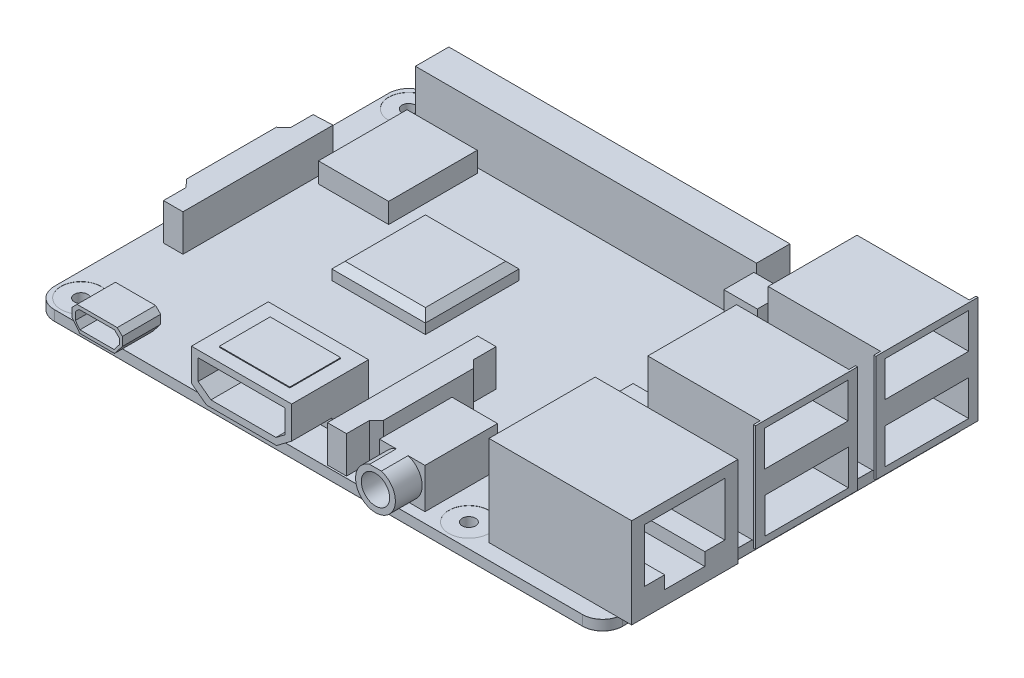
from build123d import *

# Parameters (mm, degrees)
SKETCH1_R             = 1
BOSS_EXTRUDE1_DEPTH   = 1.4732
SKETCH2_R             = 3
BOSS_EXTRUDE2_DEPTH   = 0.0254
BOSS_EXTRUDE3_START   = -1.4732
SKETCH2_2_R           = 3
BOSS_EXTRUDE3_DEPTH   = 0.0254
SKETCH3_W             = 51
SKETCH3_H             = 5
BOSS_EXTRUDE4_DEPTH   = 8.5
SKETCH3_W_2           = 5
SKETCH3_H_2           = 4.5
BOSS_EXTRUDE4_2_DEPTH = 8.5
BOSS_EXTRUDE5_DEPTH   = 16
BOSS_EXTRUDE5_2_DEPTH = 16
SKETCH5_W             = 21.336
SKETCH5_H             = 15.875
BOSS_EXTRUDE6_DEPTH   = 13.5
SKETCH6_W             = 14.986
SKETCH6_H             = 11.4935
BOSS_EXTRUDE7_DEPTH   = 6.5
BOSS_EXTRUDE8_DEPTH   = 5.5
BOSS_EXTRUDE8_2_DEPTH = 5.5
SKETCH8_W             = 6.8072
SKETCH8_H             = 14.8463
BOSS_EXTRUDE9_DEPTH   = 6
SKETCH9_OUTSIDE_W     = 110.289
SKETCH9_OUTSIDE_H     = 40.784
SKETCH9_OUTSIDE_R     = 2.97735223
CUT_EXTRUDE1_DEPTH    = 4
SKETCH10_R            = 2.119738605
CUT_EXTRUDE2_DEPTH    = 12
CUT_EXTRUDE3_DEPTH    = 6
SKETCH12_W            = 10.548519486
SKETCH12_H            = 7.613183642
BOSS_EXTRUDE10_DEPTH  = 0.127
SKETCH13_W            = 10.5
SKETCH13_H            = 13.25
BOSS_EXTRUDE11_DEPTH  = 3
SKETCH14_W            = 14
SKETCH14_H            = 14
BOSS_EXTRUDE12_DEPTH  = 2.5
CHAMFER1_SIZE         = 1
SKETCH15_W            = 7.5311
SKETCH15_H            = 5.7277
BOSS_EXTRUDE13_DEPTH  = 3.556
SKETCH16_OUTSIDE_W    = 110.289
SKETCH16_OUTSIDE_H    = 40.784
CUT_EXTRUDE4_DEPTH    = 106.594447386
SKETCH20_W            = 9
SKETCH20_H            = 9
BOSS_EXTRUDE15_DEPTH  = 1
SKETCH23_W            = 12.5
SKETCH23_H            = 5.3
CUT_EXTRUDE6_DEPTH    = 13
SKETCH26_W            = 12.5
SKETCH26_H            = 5.3
CUT_EXTRUDE7_DEPTH    = 13
SKETCH27_W            = 12
SKETCH27_H            = 8
SKETCH27_W_2          = 6
SKETCH27_H_2          = 1.922043348
CUT_EXTRUDE8_DEPTH    = 13
CUT_EXTRUDE9_DEPTH    = 10
CUT_EXTRUDE10_DEPTH   = 4


with BuildPart() as part:
    # Sketch1 → Boss-Extrude1 (new body)
    with BuildSketch(Plane(origin=(0, 0, 0), x_dir=(1, 0, 0), z_dir=(0, 1, 0))):
        with BuildLine():
            Line((3, 0), (82, 0))
            ThreePointArc((82, 0), (84.121320344, 0.878679656), (85, 3))
            Line((85, 3), (85, 53))
            ThreePointArc((85, 53), (84.121320344, 55.121320344), (82, 56))
            Line((82, 56), (3, 56))
            ThreePointArc((3, 56), (0.878679656, 55.121320344), (0, 53))
            Line((0, 53), (0, 3))
            ThreePointArc((0, 3), (0.878679656, 0.878679656), (3, 0))
        make_face()
        with Locations(Location((3.5, 52.5, 0), (0, 0, 270))):
            Circle(SKETCH1_R, mode=Mode.SUBTRACT)
        with Locations(Location((3.5, 3.5, 0), (0, 0, 270))):
            Circle(SKETCH1_R, mode=Mode.SUBTRACT)
        with Locations(Location((61.5, 3.5, 0), (0, 0, 90))):
            Circle(SKETCH1_R, mode=Mode.SUBTRACT)
        with Locations(Location((61.5, 52.5, 0), (0, 0, 90))):
            Circle(SKETCH1_R, mode=Mode.SUBTRACT)
    extrude(amount=BOSS_EXTRUDE1_DEPTH)


with BuildPart() as body_2:
    # Sketch2 → Boss-Extrude2 (new body)
    with BuildSketch(Plane(origin=(0, 1.4732, 0), x_dir=(1, 0, 0), z_dir=(0, 1, 0))):
        with BuildLine():
            Line((3, 56), (82, 56))
            ThreePointArc((82, 56), (84.121320344, 55.121320344), (85, 53))
            Line((85, 53), (85, 3))
            ThreePointArc((85, 3), (84.121320344, 0.878679656), (82, 0))
            Line((82, 0), (3, 0))
            ThreePointArc((3, 0), (0.878679656, 0.878679656), (0, 3))
            Line((0, 3), (0, 53))
            ThreePointArc((0, 53), (0.878679656, 55.121320344), (3, 56))
        make_face()
        with Locations(Location((3.5, 52.5, 0), (0, 0, 270))):
            Circle(SKETCH2_R, mode=Mode.SUBTRACT)
        with Locations(Location((3.5, 3.5, 0), (0, 0, 270))):
            Circle(SKETCH2_R, mode=Mode.SUBTRACT)
        with Locations(Location((61.5, 52.5, 0), (0, 0, 90))):
            Circle(SKETCH2_R, mode=Mode.SUBTRACT)
        with Locations(Location((61.5, 3.5, 0), (0, 0, 90))):
            Circle(SKETCH2_R, mode=Mode.SUBTRACT)
    extrude(amount=BOSS_EXTRUDE2_DEPTH)


with BuildPart() as body_3:
    # Sketch2<2> → Boss-Extrude3 (new body)
    with BuildSketch(Plane(origin=(0, 1.4732, 0), x_dir=(1, 0, 0), z_dir=(0, 1, 0)).offset(BOSS_EXTRUDE3_START)):
        with BuildLine():
            Line((3, 56), (82, 56))
            ThreePointArc((82, 56), (84.121320344, 55.121320344), (85, 53))
            Line((85, 53), (85, 3))
            ThreePointArc((85, 3), (84.121320344, 0.878679656), (82, 0))
            Line((82, 0), (3, 0))
            ThreePointArc((3, 0), (0.878679656, 0.878679656), (0, 3))
            Line((0, 3), (0, 53))
            ThreePointArc((0, 53), (0.878679656, 55.121320344), (3, 56))
        make_face()
        with Locations(Location((3.5, 52.5, 0), (0, 0, 90))):
            Circle(SKETCH2_2_R, mode=Mode.SUBTRACT)
        with Locations(Location((3.5, 3.5, 0), (0, 0, 90))):
            Circle(SKETCH2_2_R, mode=Mode.SUBTRACT)
        with Locations(Location((61.5, 52.5, 0), (0, 0, 90))):
            Circle(SKETCH2_2_R, mode=Mode.SUBTRACT)
        with Locations(Location((61.5, 3.5, 0), (0, 0, 90))):
            Circle(SKETCH2_2_R, mode=Mode.SUBTRACT)
    extrude(amount=-BOSS_EXTRUDE3_DEPTH)


with BuildPart() as body_4:
    # Sketch3 → Boss-Extrude4 (new body)
    with BuildSketch(Plane(origin=(0, 1.4986, 0), x_dir=(1, 0, 0), z_dir=(0, 1, 0))):
        with Locations((32.5, 52.5)):
            Rectangle(SKETCH3_W, SKETCH3_H)
    extrude(amount=BOSS_EXTRUDE4_DEPTH)


with BuildPart() as body_5:
    # Sketch3 → Boss-Extrude4 2 (new body)
    with BuildSketch(Plane(origin=(0, 1.4986, 0), x_dir=(1, 0, 0), z_dir=(0, 1, 0))):
        with Locations((61.5, 46.377)):
            Rectangle(SKETCH3_W_2, SKETCH3_H_2)
    extrude(amount=BOSS_EXTRUDE4_2_DEPTH)


with BuildPart() as body_6:
    # Sketch4 → Boss-Extrude5 (new body)
    with BuildSketch(Plane(origin=(0, 1.4986, 0), x_dir=(1, 0, 0), z_dir=(0, 1, 0))):
        Polygon((86.1842, 40.3579), (86.1842, 39.3579), (86.4842, 39.3579), (86.4842, 54.6421), (86.1842, 54.6421), (86.1842, 53.6421), (69.39, 53.6421), (69.39, 40.3579), align=None)
    extrude(amount=BOSS_EXTRUDE5_DEPTH)

    # Sketch23 → Cut-Extrude6 (cut)
    with BuildSketch(Plane(origin=(86.4842, 0, 0), x_dir=(0, 0, -1), z_dir=(1, 0, 0))):
        with Locations((47, 13.8486)):
            Rectangle(SKETCH23_W, SKETCH23_H)
        with Locations((47, 5.1486)):
            Rectangle(SKETCH23_W, SKETCH23_H)
    extrude(amount=-CUT_EXTRUDE6_DEPTH, mode=Mode.SUBTRACT)


with BuildPart() as body_7:
    # Sketch4 → Boss-Extrude5 2 (new body)
    with BuildSketch(Plane(origin=(0, 1.4986, 0), x_dir=(1, 0, 0), z_dir=(0, 1, 0))):
        Polygon((86.1842, 21.3579), (86.1842, 22.3579), (69.39, 22.3579), (69.39, 35.6421), (86.1842, 35.6421), (86.1842, 36.6421), (86.4842, 36.6421), (86.4842, 21.3579), align=None)
    extrude(amount=BOSS_EXTRUDE5_2_DEPTH)

    # Sketch26 → Cut-Extrude7 (cut)
    with BuildSketch(Plane(origin=(86.4842, 0, 0), x_dir=(0, 0, -1), z_dir=(1, 0, 0))):
        with Locations((28.968026832, 13.8486)):
            Rectangle(SKETCH26_W, SKETCH26_H)
        with Locations((29.031973168, 5.1486)):
            Rectangle(SKETCH26_W, SKETCH26_H)
    extrude(amount=-CUT_EXTRUDE7_DEPTH, mode=Mode.SUBTRACT)


with BuildPart() as body_8:
    # Sketch5 → Boss-Extrude6 (new body)
    with BuildSketch(Plane(origin=(0, 1.4986, 0), x_dir=(1, 0, 0), z_dir=(0, 1, 0))):
        with Locations((76.360727816, 10.25)):
            Rectangle(SKETCH5_W, SKETCH5_H)
    extrude(amount=BOSS_EXTRUDE6_DEPTH)

    # Sketch27 → Cut-Extrude8 (cut)
    with BuildSketch(Plane(origin=(87.028727816, 0, 0), x_dir=(0, 0, -1), z_dir=(1, 0, 0))):
        with Locations((10.25, 9.533229608)):
            Rectangle(SKETCH27_W, SKETCH27_H)
        with Locations((10.25, 4.572207934)):
            Rectangle(SKETCH27_W_2, SKETCH27_H_2)
    extrude(amount=-CUT_EXTRUDE8_DEPTH, mode=Mode.SUBTRACT)


with BuildPart() as body_9:
    # Sketch6 → Boss-Extrude7 (new body)
    with BuildSketch(Plane(origin=(0, 1.4986, 0), x_dir=(1, 0, 0), z_dir=(0, 1, 0))):
        with Locations((32, 4.75325)):
            Rectangle(SKETCH6_W, SKETCH6_H)
    extrude(amount=BOSS_EXTRUDE7_DEPTH)

    # Sketch11 → Cut-Extrude3 (cut)
    with BuildSketch(Plane.XY.offset(0.9935)):
        Polygon((24.507, 3.192390099), (26.76125, 1.4986), (24.507, 1.4986), align=None)
        Polygon((37.23875, 1.4986), (39.493, 3.192390099), (39.493, 1.4986), align=None)
    extrude(amount=-CUT_EXTRUDE3_DEPTH, mode=Mode.SUBTRACT)

    # Sketch29 → Cut-Extrude9 (cut)
    with BuildSketch(Plane.XY.offset(0.9935)):
        Polygon((25.507, 6.9986), (38.493, 6.9986), (38.493, 3.515676845), (37.139381579, 2.4986), (27.419281665, 2.4986), (25.507, 3.935443185), align=None)
    extrude(amount=-CUT_EXTRUDE9_DEPTH, mode=Mode.SUBTRACT)


with BuildPart() as body_10:
    # Sketch7 → Boss-Extrude8 (new body)
    with BuildSketch(Plane(origin=(0, 1.4986, 0), x_dir=(1, 0, 0), z_dir=(0, 1, 0))):
        Polygon((5.468754386, 39.225899983), (5.468754386, 16.774100017), (2.559176529, 16.774100017), (2.559176529, 20.135675496), (1.495054958, 21.300957598), (1.495054958, 34.699042402), (2.610903759, 35.71802208), (2.610903759, 39.094358133), align=None)
    extrude(amount=BOSS_EXTRUDE8_DEPTH)


with BuildPart() as body_11:
    # Sketch7 → Boss-Extrude8 2 (new body)
    with BuildSketch(Plane(origin=(0, 1.4986, 0), x_dir=(1, 0, 0), z_dir=(0, 1, 0))):
        Polygon((43.57118194, 22.726142342), (43.57118194, 0.273857658), (46.42881806, 0.273857658), (46.42881806, 3.719545369), (47.464408165, 4.755135475), (47.464408165, 18.244864525), (46.343297398, 19.365975292), (46.343297398, 22.726142342), align=None)
    extrude(amount=BOSS_EXTRUDE8_2_DEPTH)


with BuildPart() as body_12:
    # Sketch8 → Boss-Extrude9 (new body)
    with BuildSketch(Plane(origin=(0, 1.4986, 0), x_dir=(1, 0, 0), z_dir=(0, 1, 0))):
        with Locations((53.5, 4.953066803)):
            Rectangle(SKETCH8_W, SKETCH8_H)
    extrude(amount=BOSS_EXTRUDE9_DEPTH)

    # Sketch9 outside → Cut-Extrude1 (cut)
    with BuildSketch(Plane.XY.offset(2.470083197)):
        with Locations((43.5145, 8.737)):
            Rectangle(SKETCH9_OUTSIDE_W, SKETCH9_OUTSIDE_H)
        with Locations((53.5, 4.65459777)):
            Circle(SKETCH9_OUTSIDE_R, mode=Mode.SUBTRACT)
    extrude(amount=-CUT_EXTRUDE1_DEPTH, mode=Mode.SUBTRACT)

    # Sketch10 → Cut-Extrude2 (cut)
    with BuildSketch(Plane.XY.offset(2.470083197)):
        with Locations((53.5, 4.65459777)):
            Circle(SKETCH10_R)
    extrude(amount=-CUT_EXTRUDE2_DEPTH, mode=Mode.SUBTRACT)


with BuildPart() as body_13:
    # Sketch12 → Boss-Extrude10 (new body)
    with BuildSketch(Plane(origin=(0, 7.9986, 0), x_dir=(1, 0, 0), z_dir=(0, 1, 0))):
        with Locations((32, 4.75325)):
            Rectangle(SKETCH12_W, SKETCH12_H)
    extrude(amount=BOSS_EXTRUDE10_DEPTH)


with BuildPart() as body_14:
    # Sketch13 → Boss-Extrude11 (new body)
    with BuildSketch(Plane(origin=(0, 1.4986, 0), x_dir=(1, 0, 0), z_dir=(0, 1, 0))):
        with Locations((11.75, 42.625)):
            Rectangle(SKETCH13_W, SKETCH13_H)
    extrude(amount=BOSS_EXTRUDE11_DEPTH)


with BuildPart() as body_15:
    # Sketch14 → Boss-Extrude12 (new body)
    with BuildSketch(Plane(origin=(0, 1.4986, 0), x_dir=(1, 0, 0), z_dir=(0, 1, 0))):
        with Locations((27, 31.5)):
            Rectangle(SKETCH14_W, SKETCH14_H)
    extrude(amount=BOSS_EXTRUDE12_DEPTH)

    # Chamfer1
    chamfer1_edges = [body_15.edges().sort_by_distance(p)[0] for p in [
        (34, 3.9986, -31.5),
        (27, 3.9986, -38.5),
        (20, 3.9986, -31.5),
        (27, 3.9986, -24.5),
    ]]
    chamfer(chamfer1_edges, length=CHAMFER1_SIZE)


with BuildPart() as body_16:
    # Sketch15 → Boss-Extrude13 (new body)
    with BuildSketch(Plane(origin=(0, 1.4986, 0), x_dir=(1, 0, 0), z_dir=(0, 1, 0))):
        with Locations((10.6, 1.680051145)):
            Rectangle(SKETCH15_W, SKETCH15_H)
    extrude(amount=BOSS_EXTRUDE13_DEPTH)

    # Sketch16 outside → Cut-Extrude4 (cut, through all)
    with BuildSketch(Plane.XY.offset(1.183798855)):
        with Locations((43.5145, 8.737)):
            Rectangle(SKETCH16_OUTSIDE_W, SKETCH16_OUTSIDE_H)
        Polygon((8.003623328, 1.4986), (6.83445, 2.984347439), (6.83445, 4.292116269), (7.596933731, 5.0546), (13.603066269, 5.0546), (14.36555, 4.292116269), (14.36555, 2.984347439), (13.196376672, 1.4986), align=None, mode=Mode.SUBTRACT)
    extrude(amount=-CUT_EXTRUDE4_DEPTH, mode=Mode.SUBTRACT)

    # Sketch30 → Cut-Extrude10 (cut)
    with BuildSketch(Plane.XY.offset(1.183798855)):
        Polygon((7.341692887, 2.842393911), (7.341692887, 4.003211598), (7.893081289, 4.5546), (13.20382221, 4.5546), (13.924841502, 3.833580708), (13.924841502, 2.992985752), (13.122345553, 1.9732), (8.025684197, 1.9732), align=None)
    extrude(amount=-CUT_EXTRUDE10_DEPTH, mode=Mode.SUBTRACT)


with BuildPart() as body_17:
    # Sketch20 → Boss-Extrude15 (new body)
    with BuildSketch(Plane(origin=(0, 1.4986, 0), x_dir=(1, 0, 0), z_dir=(0, 1, 0))):
        with Locations((61.360004184, 28.190121341)):
            Rectangle(SKETCH20_W, SKETCH20_H)
    extrude(amount=BOSS_EXTRUDE15_DEPTH)


solid = Compound([part.part, body_2.part, body_3.part, body_4.part, body_5.part, body_6.part, body_7.part, body_8.part, body_9.part, body_10.part, body_11.part, body_12.part, body_13.part, body_14.part, body_15.part, body_16.part, body_17.part])
